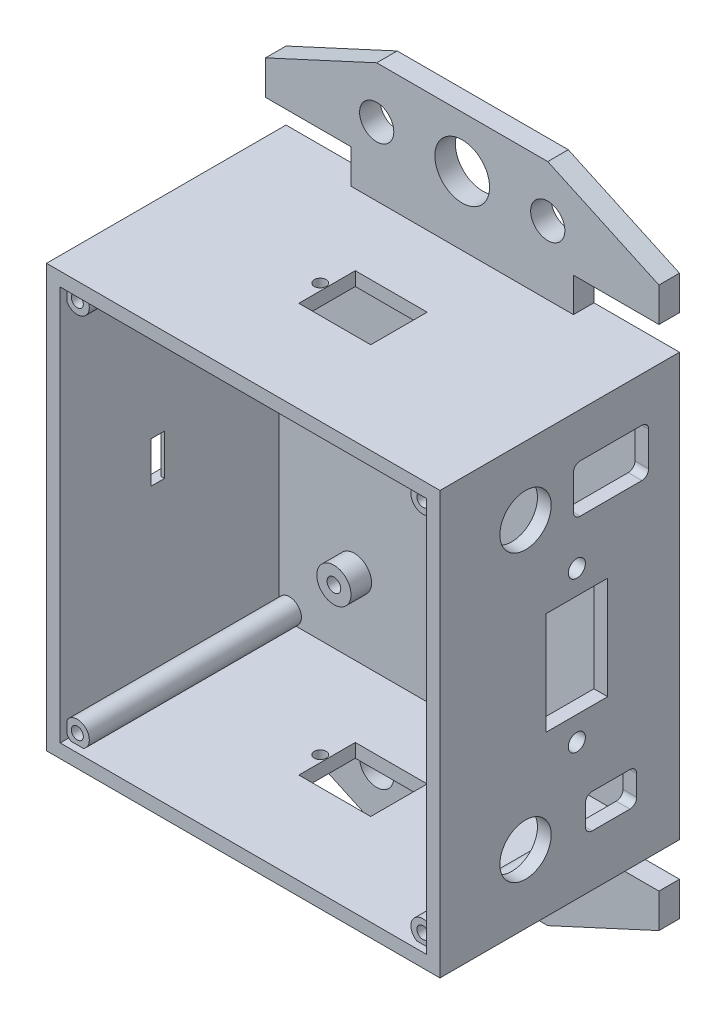
from build123d import *

# Parameters (mm, degrees)
CROQUIS1_W                 = 107
CROQUIS1_H                 = 115.41
CROQUIS1_R                 = 2
SALIENTE_EXTRUIR1_DEPTH    = 6
CROQUIS2_W                 = 115
CROQUIS2_H                 = 123.41
CROQUIS2_W_2               = 107
CROQUIS2_H_2               = 115.41
SALIENTE_EXTRUIR2_DEPTH    = 70
CROQUIS3_R                 = 7.5
CORTAR_EXTRUIR1_DEPTH      = 51
CORTAR_EXTRUIR2_DEPTH      = 166
CORTAR_EXTRUIR2_DEPTH_BACK = 31
CROQUIS4_R                 = 1.75
CROQUIS4_W                 = 21
CROQUIS4_H                 = 16.5
CROQUIS6_W                 = 17
CROQUIS6_H                 = 12
CORTAR_EXTRUIR3_DEPTH      = 3
CORTAR_EXTRUIR4_DEPTH      = 18
CORTAR_EXTRUIR4_DEPTH_BACK = 21
CROQUIS8_W                 = 30
CROQUIS8_H                 = 40
CORTAR_EXTRUIR5_DEPTH      = 1
CROQUIS9_R                 = 5
CROQUIS9_R_2               = 1.999291975
CROQUIS9_R_3               = 2
SALIENTE_EXTRUIR3_DEPTH    = 12
CROQUIS10_R                = 3.5
CORTAR_EXTRUIR6_DEPTH      = 3
CROQUIS11_R                = 3.5
CROQUIS11_R_2              = 1.75
SALIENTE_EXTRUIR4_DEPTH    = 68
CROQUIS12_R                = 5
CROQUIS12_R_2              = 8
SALIENTE_EXTRUIR5_DEPTH    = 6
CROQUIS13_R                = 2.5
CROQUIS13_W                = 18
CROQUIS13_H                = 30
CORTAR_EXTRUIR7_DEPTH      = 10


with BuildPart() as part:
    # Croquis1 → Saliente-Extruir1 (new body)
    with BuildSketch(Plane.XY):
        with Locations((31.5, 35.705)):
            Rectangle(CROQUIS1_W, CROQUIS1_H)
        Circle(CROQUIS1_R, mode=Mode.SUBTRACT)
        with Locations((38, 0)):
            Circle(CROQUIS1_R, mode=Mode.SUBTRACT)
        with Locations((38, 71.41)):
            Circle(CROQUIS1_R, mode=Mode.SUBTRACT)
    extrude(amount=SALIENTE_EXTRUIR1_DEPTH)

    # Croquis2 → Saliente-Extruir2 (add)
    with BuildSketch(Plane.XY):
        with Locations((31.5, 35.705)):
            Rectangle(CROQUIS2_W, CROQUIS2_H)
        with Locations((31.5, 35.705)):
            Rectangle(CROQUIS2_W_2, CROQUIS2_H_2, mode=Mode.SUBTRACT)
    extrude(amount=SALIENTE_EXTRUIR2_DEPTH)

    # Croquis3 → Cortar-Extruir1 (cut)
    with BuildSketch(Plane(origin=(90, 0, 0), x_dir=(0, 0, -1), z_dir=(1, 0, 0))):
        with Locations(Location((-45, 77.41, 0), (0, 0, 180))):
            Circle(CROQUIS3_R)
        with Locations(Location((-45, -6, 0), (0, 0, 180))):
            Circle(CROQUIS3_R)
        with BuildLine():
            Line((-14.5, -1), (-25.5, -1))
            ThreePointArc((-25.5, -1), (-26.914213562, -1.585786438), (-27.5, -3))
            Line((-27.5, -3), (-27.5, -9))
            ThreePointArc((-27.5, -9), (-26.914213562, -10.414213562), (-25.5, -11))
            Line((-25.5, -11), (-14.5, -11))
            ThreePointArc((-14.5, -11), (-13.085786438, -10.414213562), (-12.5, -9))
            Line((-12.5, -9), (-12.5, -3))
            ThreePointArc((-12.5, -3), (-13.085786438, -1.585786438), (-14.5, -1))
        make_face()
        with BuildLine():
            Line((-29, 84.41), (-11, 84.41))
            ThreePointArc((-11, 84.41), (-9.585786438, 83.824213562), (-9, 82.41))
            Line((-9, 82.41), (-9, 72.41))
            ThreePointArc((-9, 72.41), (-9.585786438, 70.995786438), (-11, 70.41))
            Line((-11, 70.41), (-29, 70.41))
            ThreePointArc((-29, 70.41), (-30.414213562, 70.995786438), (-31, 72.41))
            Line((-31, 72.41), (-31, 82.41))
            ThreePointArc((-31, 82.41), (-30.414213562, 83.824213562), (-29, 84.41))
        make_face()
    extrude(amount=-CORTAR_EXTRUIR1_DEPTH, mode=Mode.SUBTRACT)

    # Croquis4 → Cortar-Extruir2 (cut, two sides: drawn at the far end of the back side and taken through both)
    with BuildSketch(Plane(origin=(0, -30, 0), x_dir=(1, 0, 0), z_dir=(0, 1, 0)).offset(-CORTAR_EXTRUIR2_DEPTH_BACK)):
        with Locations(Location((19, -35, 0), (0, 0, 90))):
            Circle(CROQUIS4_R)
        with Locations((31.5, -35)):
            Rectangle(CROQUIS4_W, CROQUIS4_H)
    extrude(amount=CORTAR_EXTRUIR2_DEPTH + CORTAR_EXTRUIR2_DEPTH_BACK, mode=Mode.SUBTRACT)

    # Croquis6 → Cortar-Extruir3 (cut)
    with BuildSketch(Plane(origin=(-26, 0, 0), x_dir=(0, 0, -1), z_dir=(1, 0, 0))):
        with Locations((-35, 35.705)):
            Rectangle(CROQUIS6_W, CROQUIS6_H)
    extrude(amount=CORTAR_EXTRUIR3_DEPTH, mode=Mode.SUBTRACT)

    # Croquis7 → Cortar-Extruir4 (cut, two sides: drawn at the far end of the back side and taken through both)
    with BuildSketch(Plane(origin=(-26, 0, 0), x_dir=(0, 0, -1), z_dir=(1, 0, 0)).offset(-CORTAR_EXTRUIR4_DEPTH_BACK)):
        Polygon((-43.5, 41.705), (-40.5, 41.705), (-39.5, 41.705), (-39.5, 29.705), (-40.5, 29.705), (-43.5, 29.705), align=None)
    extrude(amount=CORTAR_EXTRUIR4_DEPTH + CORTAR_EXTRUIR4_DEPTH_BACK, mode=Mode.SUBTRACT)

    # Croquis8 → Cortar-Extruir5 (cut)
    with BuildSketch(Plane(origin=(-26, 0, 0), x_dir=(0, 0, -1), z_dir=(1, 0, 0))):
        with Locations((-35, 35.705)):
            Rectangle(CROQUIS8_W, CROQUIS8_H)
    extrude(amount=CORTAR_EXTRUIR5_DEPTH, mode=Mode.SUBTRACT)

    # Croquis9 → Saliente-Extruir3 (add)
    # profile 1 of 3: a face of its own
    with BuildSketch(Plane.XY):
        with Locations(Location((38, 0, 0), (0, 0, 180))):
            Circle(CROQUIS9_R)
        with Locations((38, 0)):
            Circle(CROQUIS9_R_2, mode=Mode.SUBTRACT)
    # profile 2 of 3: a face of its own
    with BuildSketch(Plane.XY):
        with Locations(Location((0, 0, 0), (0, 0, 180))):
            Circle(CROQUIS9_R)
        Circle(CROQUIS9_R_3, mode=Mode.SUBTRACT)
    # profile 3 of 3: a face of its own
    with BuildSketch(Plane.XY):
        with Locations(Location((38, 71.41, 0), (0, 0, 180))):
            Circle(CROQUIS9_R)
        with Locations((38, 71.41)):
            Circle(CROQUIS9_R_3, mode=Mode.SUBTRACT)
    extrude(amount=SALIENTE_EXTRUIR3_DEPTH)

    # Croquis10 → Cortar-Extruir6 (cut)
    with BuildSketch(Plane.XY):
        with Locations((38, 71.41)):
            Circle(CROQUIS10_R)
        Circle(CROQUIS10_R)
        with Locations((38, 0)):
            Circle(CROQUIS10_R)
    extrude(amount=CORTAR_EXTRUIR6_DEPTH, mode=Mode.SUBTRACT)

    # Croquis11 → Saliente-Extruir4 (add)
    # profile 1 of 4: a face of its own
    with BuildSketch(Plane.XY):
        with Locations((-19, -19)):
            Circle(CROQUIS11_R)
        with Locations(Location((-19, -19, 0), (0, 0, 180))):
            Circle(CROQUIS11_R_2, mode=Mode.SUBTRACT)
    # profile 2 of 4: a face of its own
    with BuildSketch(Plane.XY):
        with Locations((-19, 90.41)):
            Circle(CROQUIS11_R)
        with Locations(Location((-19, 90.41, 0), (0, 0, 180))):
            Circle(CROQUIS11_R_2, mode=Mode.SUBTRACT)
    # profile 3 of 4: a face of its own
    with BuildSketch(Plane.XY):
        with Locations((82, 90.41)):
            Circle(CROQUIS11_R)
        with Locations(Location((82, 90.41, 0), (0, 0, 180))):
            Circle(CROQUIS11_R_2, mode=Mode.SUBTRACT)
    # profile 4 of 4: a face of its own
    with BuildSketch(Plane.XY):
        with Locations((82, -19)):
            Circle(CROQUIS11_R)
        with Locations(Location((82, -19, 0), (0, 0, 180))):
            Circle(CROQUIS11_R_2, mode=Mode.SUBTRACT)
    extrude(amount=SALIENTE_EXTRUIR4_DEPTH)

    # Croquis12 → Saliente-Extruir5 (add)
    # profile 1 of 2: a face of its own
    with BuildSketch(Plane.XY):
        Polygon((64, 97.41), (-1, 97.41), (-1, 107.41), (-26, 107.41), (-26, 117.41), (6.5, 132.41), (56.5, 132.41), (89, 117.41), (89, 107.41), (64, 107.41), align=None)
        with Locations((56.5, 117.41)):
            Circle(CROQUIS12_R, mode=Mode.SUBTRACT)
        with Locations((6.5, 117.41)):
            Circle(CROQUIS12_R, mode=Mode.SUBTRACT)
        with Locations((31.5, 117.41)):
            Circle(CROQUIS12_R_2, mode=Mode.SUBTRACT)
    # profile 2 of 2: a face of its own
    with BuildSketch(Plane.XY):
        Polygon((-1, -36), (-26, -36), (-26, -46), (6.5, -61), (56.5, -61), (89, -46), (89, -36), (64, -36), (64, -26), (-1, -26), align=None)
        with Locations((56.5, -46)):
            Circle(CROQUIS12_R, mode=Mode.SUBTRACT)
        with Locations((31.5, -46)):
            Circle(CROQUIS12_R_2, mode=Mode.SUBTRACT)
        with Locations((6.5, -46)):
            Circle(CROQUIS12_R, mode=Mode.SUBTRACT)
    extrude(amount=SALIENTE_EXTRUIR5_DEPTH)

    # Croquis13 → Cortar-Extruir7 (cut)
    with BuildSketch(Plane(origin=(90, 0, 0), x_dir=(0, 0, -1), z_dir=(1, 0, 0))):
        with Locations(Location((-30, 13.705, 0), (0, 0, 180))):
            Circle(CROQUIS13_R)
        with Locations(Location((-30, 57.705, 0), (0, 0, 180))):
            Circle(CROQUIS13_R)
        with Locations((-30, 35.705)):
            Rectangle(CROQUIS13_W, CROQUIS13_H)
    extrude(amount=-CORTAR_EXTRUIR7_DEPTH, mode=Mode.SUBTRACT)


solid = part.part
